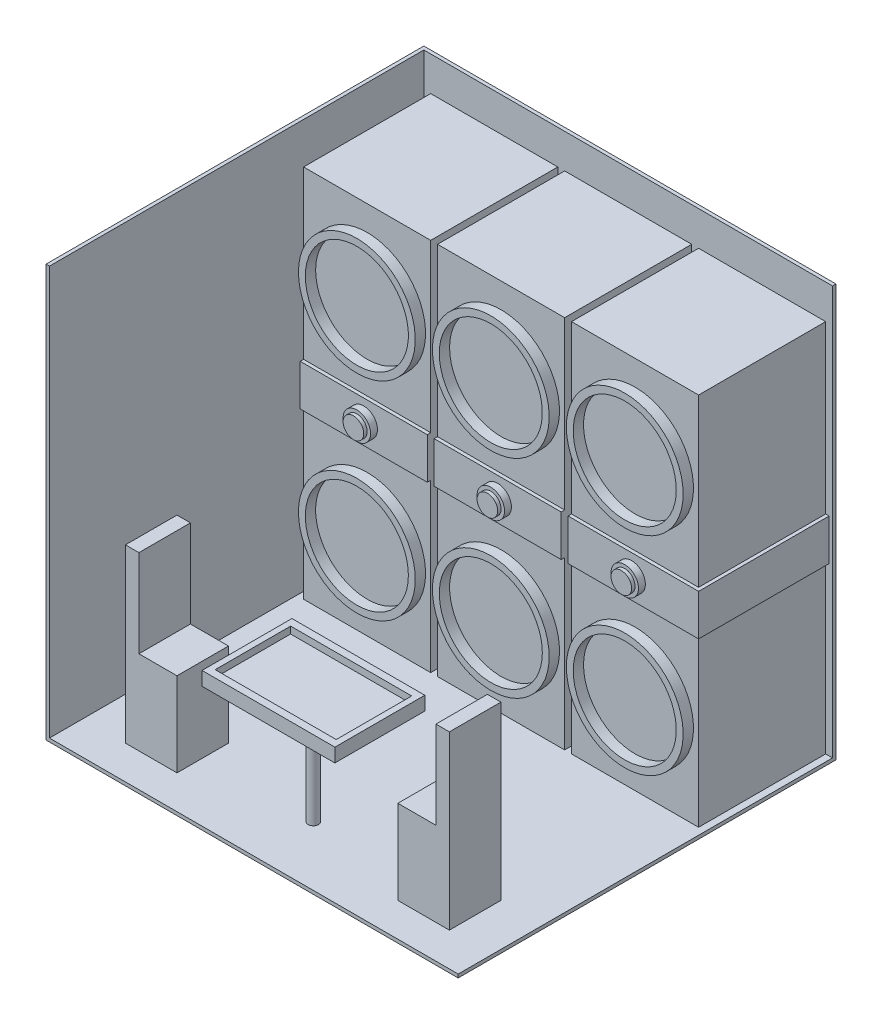
from build123d import *

# Parameters (mm, degrees)
SKETCH_1_W           = 120
SKETCH_1_H           = 110
EXTRUDE_1_DEPTH      = 120
SKETCH_2_W           = 119
SKETCH_2_H           = 119
CUT_EXTRUDE_1_DEPTH  = 109
SKETCH_54_W          = 37
SKETCH_54_H          = 37
EXTRUDE_32_DEPTH     = 109
SKETCH_55_W          = 37
SKETCH_55_H          = 12
EXTRUDE_33_DEPTH     = 1
SKETCH_56_R          = 4
EXTRUDE_34_DEPTH     = 2
SKETCH_57_R          = 3
EXTRUDE_35_DEPTH     = 1
SKETCH_59_R          = 17
SKETCH_59_R_2        = 15
EXTRUDE_36_DEPTH     = 3
SKETCH_60_W          = 38
SKETCH_60_H          = 12
EXTRUDE_37_DEPTH     = 1
SKETCH_61_R          = 1.5
EXTRUDE_38_DEPTH     = 31
SKETCH_62_W          = 38.68188347
SKETCH_62_H          = 26.17234464
EXTRUDE_39_DEPTH     = 4
SKETCH_63_W          = 35.246239362
SKETCH_63_H          = 21.9665941
CUT_EXTRUDE_9_DEPTH  = 2
SKETCH_65_W          = 15
SKETCH_65_H          = 15
EXTRUDE_40_DEPTH     = 50
SKETCH_66_W          = 11.082023192
SKETCH_66_H          = 25.508987467
CUT_EXTRUDE_10_DEPTH = 30


with BuildPart() as part:
    # 스케치1 → 보스-돌출1 (new body)
    with BuildSketch(Plane(origin=(0, 0, 0), x_dir=(1, 0, 0), z_dir=(0, 1, 0))):
        Rectangle(SKETCH_1_W, SKETCH_1_H)
    extrude(amount=EXTRUDE_1_DEPTH)

    # 스케치2 → 컷-돌출1 (cut)
    with BuildSketch(Plane.XY.offset(55)):
        with Locations((0.5, 60.5)):
            Rectangle(SKETCH_2_W, SKETCH_2_H)
    extrude(amount=-CUT_EXTRUDE_1_DEPTH, mode=Mode.SUBTRACT)

    # 스케치54 → 보스-돌출32 (add)
    with BuildSketch(Plane(origin=(0, 1, 0), x_dir=(1, 0, 0), z_dir=(0, 1, 0))):
        with Locations((-38.5, 35.5)):
            Rectangle(SKETCH_54_W, SKETCH_54_H)
        with Locations((0.5, 35.5)):
            Rectangle(SKETCH_54_W, SKETCH_54_H)
        with Locations((39.5, 35.5)):
            Rectangle(SKETCH_54_W, SKETCH_54_H)
    extrude(amount=EXTRUDE_32_DEPTH)

    # 스케치55 → 보스-돌출33 (add)
    with BuildSketch(Plane.XY.offset(-17)):
        with Locations((-38.5, 55.5)):
            Rectangle(SKETCH_55_W, SKETCH_55_H)
        with Locations((0.5, 55.5)):
            Rectangle(SKETCH_55_W, SKETCH_55_H)
        with Locations((39.5, 55.5)):
            Rectangle(SKETCH_55_W, SKETCH_55_H)
    extrude(amount=EXTRUDE_33_DEPTH)

    # 스케치56 → 보스-돌출34 (add)
    with BuildSketch(Plane.XY.offset(-16)):
        with Locations((-38.5, 55.5)):
            Circle(SKETCH_56_R)
        with Locations(Location((39.5, 55.5, 0), (0, 0, 180))):
            Circle(SKETCH_56_R)
        with Locations((0.5, 55.5)):
            Circle(SKETCH_56_R)
    extrude(amount=EXTRUDE_34_DEPTH)

    # 스케치57 → 보스-돌출35 (add)
    with BuildSketch(Plane.XY.offset(-14)):
        with Locations((0.5, 55.5)):
            Circle(SKETCH_57_R)
        with Locations((39.5, 55.5)):
            Circle(SKETCH_57_R)
        with Locations((-38.5, 55.5)):
            Circle(SKETCH_57_R)
    extrude(amount=EXTRUDE_35_DEPTH)

    # 스케치59 → 보스-돌출36 (add)
    # profile 1 of 6: a face of its own
    with BuildSketch(Plane.XY.offset(-17)):
        with Locations(Location((-38.5, 25.25, 0), (0, 0, 180))):
            Circle(SKETCH_59_R)
        with Locations((-38.5, 25.25)):
            Circle(SKETCH_59_R_2, mode=Mode.SUBTRACT)
    # profile 2 of 6: a face of its own
    with BuildSketch(Plane.XY.offset(-17)):
        with Locations(Location((39.5, 25.25, 0), (0, 0, 180))):
            Circle(SKETCH_59_R)
        with Locations(Location((39.5, 25.25, 0), (0, 0, 180))):
            Circle(SKETCH_59_R_2, mode=Mode.SUBTRACT)
    # profile 3 of 6: a face of its own
    with BuildSketch(Plane.XY.offset(-17)):
        with Locations(Location((39.5, 85.75, 0), (0, 0, 180))):
            Circle(SKETCH_59_R)
        with Locations((39.5, 85.75)):
            Circle(SKETCH_59_R_2, mode=Mode.SUBTRACT)
    # profile 4 of 6: a face of its own
    with BuildSketch(Plane.XY.offset(-17)):
        with Locations(Location((-38.5, 85.75, 0), (0, 0, 180))):
            Circle(SKETCH_59_R)
        with Locations(Location((-38.5, 85.75, 0), (0, 0, 180))):
            Circle(SKETCH_59_R_2, mode=Mode.SUBTRACT)
    # profile 5 of 6: a face of its own
    with BuildSketch(Plane.XY.offset(-17)):
        with Locations(Location((0.5, 25.25, 0), (0, 0, 180))):
            Circle(SKETCH_59_R)
        with Locations((0.5, 25.25)):
            Circle(SKETCH_59_R_2, mode=Mode.SUBTRACT)
    # profile 6 of 6: a face of its own
    with BuildSketch(Plane.XY.offset(-17)):
        with Locations(Location((0.5, 85.75, 0), (0, 0, 180))):
            Circle(SKETCH_59_R)
        with Locations(Location((0.5, 85.75, 0), (0, 0, 180))):
            Circle(SKETCH_59_R_2, mode=Mode.SUBTRACT)
    extrude(amount=EXTRUDE_36_DEPTH)

    # 스케치60 → 보스-돌출37 (add)
    with BuildSketch(Plane(origin=(58, 0, 0), x_dir=(0, 0, -1), z_dir=(1, 0, 0))):
        with Locations((35, 55.5)):
            Rectangle(SKETCH_60_W, SKETCH_60_H)
    extrude(amount=EXTRUDE_37_DEPTH)

    # 스케치61 → 보스-돌출38 (add)
    with BuildSketch(Plane(origin=(0, 1, 0), x_dir=(1, 0, 0), z_dir=(0, 1, 0))):
        with Locations((0.5, -37.648978871)):
            Circle(SKETCH_61_R)
    extrude(amount=EXTRUDE_38_DEPTH)

    # 스케치62 → 보스-돌출39 (add)
    with BuildSketch(Plane(origin=(0, 32, 0), x_dir=(1, 0, 0), z_dir=(0, 1, 0))):
        with Locations((0.5, -37.648978871)):
            Rectangle(SKETCH_62_W, SKETCH_62_H)
    extrude(amount=EXTRUDE_39_DEPTH)

    # 스케치63 → 컷-돌출9 (cut)
    with BuildSketch(Plane(origin=(0, 36, 0), x_dir=(1, 0, 0), z_dir=(0, 1, 0))):
        with Locations((0.5, -37.642682595)):
            Rectangle(SKETCH_63_W, SKETCH_63_H)
    extrude(amount=-CUT_EXTRUDE_9_DEPTH, mode=Mode.SUBTRACT)

    # 스케치65 → 보스-돌출40 (add)
    with BuildSketch(Plane(origin=(0, 1, 0), x_dir=(1, 0, 0), z_dir=(0, 1, 0))):
        with Locations((-39.153156526, -37.716582515)):
            Rectangle(SKETCH_65_W, SKETCH_65_H)
        with Locations((40.153156526, -37.716582515)):
            Rectangle(SKETCH_65_W, SKETCH_65_H)
    extrude(amount=EXTRUDE_40_DEPTH)

    # 스케치66 → 컷-돌출10 (cut)
    with BuildSketch(Plane.XY.offset(45.216582515)):
        with Locations((-37.194168122, 38.245506267)):
            Rectangle(SKETCH_66_W, SKETCH_66_H)
        with Locations((38.194168122, 38.245506267)):
            Rectangle(SKETCH_66_W, SKETCH_66_H)
    extrude(amount=-CUT_EXTRUDE_10_DEPTH, mode=Mode.SUBTRACT)


solid = part.part
